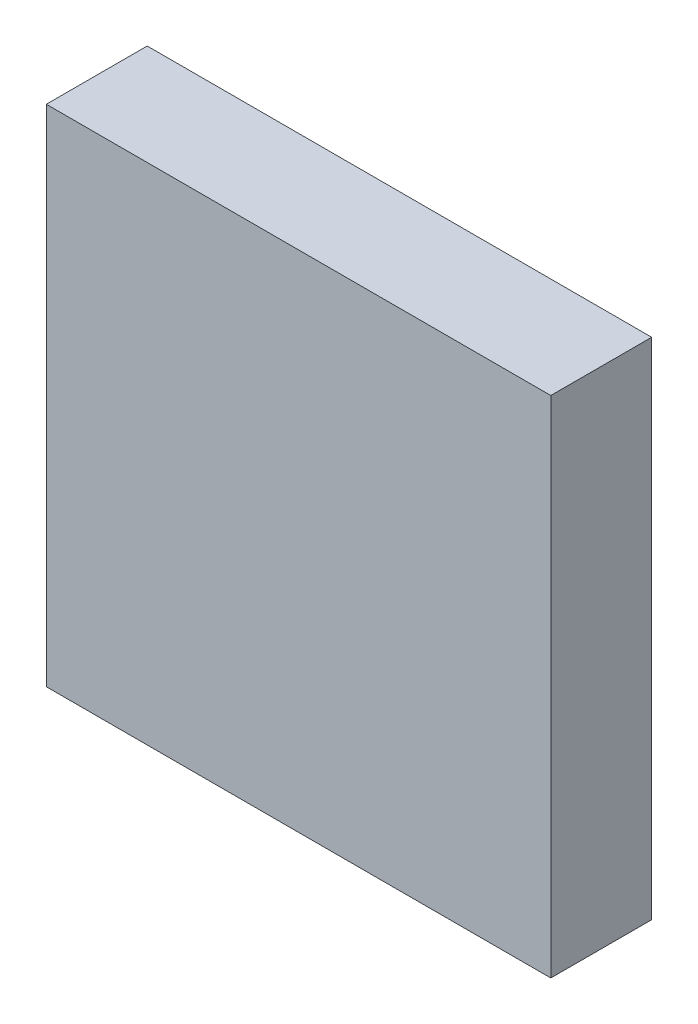
from build123d import *

# Parameters (mm, degrees)
SKETCH_216_W          = 30
SKETCH_216_H          = 30
EXTRUDE_266_DEPTH     = 6
SKETCH_329_W          = 2.034587996
SKETCH_329_H          = 1.037639878
SKETCH_329_W_2        = 1.993896236
SKETCH_329_H_2        = 1.047812818
CUT_EXTRUDE_795_DEPTH = 0.3


with BuildPart() as part:
    # Sketch 216 → Extrude 266 (new body)
    with BuildSketch(Plane.XY.offset(1.6)):
        with Locations((15, -35)):
            Rectangle(SKETCH_216_W, SKETCH_216_H)
    extrude(amount=EXTRUDE_266_DEPTH)

    # Sketch 329 → Cut-Extrude 795 (cut)
    # profile 1 of 5: a face of its own
    with BuildSketch(Plane.XY.offset(1.6)):
        Polygon((16.602238047, -31.332655137), (16.602238047, -36.861648016), (16.431841302, -36.930739234), (16.249576128, -36.998982706), (16.055442523, -37.066378433), (15.849440488, -37.132926416), (15.631570024, -37.198626653), (15.401831129, -37.263479145), (15.499463095, -37.820730191), (15.609246072, -38.29885837), (15.731180061, -38.697863683), (15.865265062, -39.017746129), (16.011501074, -39.258505708), (16.169888098, -39.420142421), (16.34325195, -39.532044761), (16.534418447, -39.623601221), (16.743387589, -39.694811801), (16.970159376, -39.745676501), (17.214733808, -39.77619532), (17.477110885, -39.78636826), (19.91861648, -39.78636826), (20.425285407, -39.744546174), (20.839832712, -39.619079914), (21.162258393, -39.409969481), (21.392562451, -39.117214875), (21.530744885, -38.740816096), (21.576805697, -38.280773143), (21.576805697, -37.263479145), (23.570701933, -37.263479145), (23.570701933, -38.056968464), (25.03560529, -38.056968464), (25.03560529, -31.332655137), (21.576805697, -31.332655137), (21.576805697, -30.08138352), (20.1017294, -30.08138352), (20.1017294, -31.332655137), align=None)
        with Locations((19.084435402, -33.133265514)):
            Rectangle(SKETCH_329_W, SKETCH_329_H, mode=Mode.SUBTRACT)
        with Locations((22.573753815, -33.133265514)):
            Rectangle(SKETCH_329_W_2, SKETCH_329_H, mode=Mode.SUBTRACT)
        with Locations((19.084435402, -35.457782299)):
            Rectangle(SKETCH_329_W, SKETCH_329_H_2, mode=Mode.SUBTRACT)
        with Locations((22.573753815, -35.457782299)):
            Rectangle(SKETCH_329_W_2, SKETCH_329_H_2, mode=Mode.SUBTRACT)
        Polygon((19.481180061, -38.524923703), (17.955239064, -38.524923703), (17.83415282, -38.521320787), (17.721826608, -38.510512038), (17.618260427, -38.492497457), (17.523454278, -38.467277043), (17.437408161, -38.434850797), (17.360122075, -38.395218718), (17.291525376, -38.349299197), (17.231547417, -38.298010625), (17.180188199, -38.241353001), (17.137447722, -38.179326325), (17.103325986, -38.111930598), (17.077822991, -38.039165819), (17.055852266, -37.954744546), (17.032327343, -37.852379338), (17.00724822, -37.732070193), (16.980614898, -37.593817113), (16.952427377, -37.437620097), (16.922685656, -37.263479145), (20.1017294, -37.263479145), (20.1017294, -37.985757884), (20.084491918, -38.150502995), (20.032779473, -38.28529445), (19.946592065, -38.390132248), (19.825929694, -38.46501639), (19.670792359, -38.509946875), align=None, mode=Mode.SUBTRACT)
    # profile 2 of 5: a face of its own
    with BuildSketch(Plane.XY.offset(1.6)):
        Polygon((5.483214649, -31.566632757), (5.497979541, -32.664179948), (5.515146377, -33.596699446), (5.534715158, -34.364191251), (5.556685882, -34.966655363), (5.581058551, -35.404091783), (5.607833164, -35.676500509), (5.641813609, -35.858906974), (5.687803775, -36.026336611), (5.745803662, -36.17878942), (5.81581327, -36.316265401), (5.897832599, -36.438764553), (5.991861648, -36.546286877), (6.117327908, -36.639397536), (6.293658867, -36.718661693), (6.520854527, -36.784079349), (6.798914886, -36.835650503), (7.127839946, -36.873375155), (7.507629705, -36.897253306), (7.559624732, -36.67062281), (7.613880411, -36.44512264), (7.670396745, -36.220752798), (7.729173731, -35.997513281), (7.790211371, -35.775404092), (7.853509664, -35.554425229), (7.604979089, -35.564386233), (7.395162202, -35.563750424), (7.224059003, -35.552517803), (7.091669492, -35.530688369), (6.99799367, -35.498262123), (6.943031536, -35.455239064), (6.910393354, -35.353297728), (6.883689386, -35.14411665), (6.862919634, -34.827695829), (6.848084096, -34.404035266), (6.839182774, -33.873134961), (6.836215666, -33.234994914), (8.016276704, -33.514750763), (8.016276704, -38.006103764), (9.399796541, -38.006103764), (9.399796541, -33.840284842), (10.406917599, -34.074262462), (10.406917599, -38.006103764), (10.391093026, -38.186390867), (10.343619306, -38.333898497), (10.264496439, -38.448626653), (10.153724426, -38.530575336), (10.011303267, -38.579744546), (9.83723296, -38.596134283), (7.365208545, -38.596134283), (7.210353792, -38.590341359), (7.071323613, -38.572962586), (6.948118006, -38.543997965), (6.840736973, -38.503447496), (6.749180513, -38.451311179), (6.673448627, -38.387589013), (6.607607098, -38.289391884), (6.545721714, -38.133830677), (6.487792472, -37.920905392), (6.433819374, -37.650616028), (6.383802419, -37.322962586), (6.337741607, -36.937945066), (6.110263366, -37.038544139), (5.882219962, -37.136882559), (5.653611394, -37.232960326), (5.424437662, -37.326777439), (5.194698768, -37.418333898), (4.96439471, -37.507629705), (5.05425568, -37.965200068), (5.15428959, -38.364699898), (5.264496439, -38.706129196), (5.384876229, -38.989487962), (5.515428959, -39.214776195), (5.656154629, -39.381993896), (5.808466147, -39.508661128), (5.973776421, -39.612297954), (6.152085453, -39.692904374), (6.343393241, -39.750480389), (6.547699785, -39.785025998), (6.765005086, -39.7965412), (10.254323499, -39.7965412), (10.723691647, -39.749915226), (11.107720131, -39.610037301), (11.406408952, -39.376907426), (11.61975811, -39.050525602), (11.747767605, -38.630891828), (11.790437436, -38.118006104), (11.790437436, -34.399796541), (12.380467955, -34.537131231), (12.675483215, -33.224821974), (11.790437436, -33.021363174), (11.790437436, -30.905391658), (10.406917599, -30.905391658), (10.406917599, -32.706002035), (9.399796541, -32.472024415), (9.399796541, -30), (8.016276704, -30), (8.016276704, -32.151576806), align=None)
    # profile 3 of 5: a face of its own
    with BuildSketch(Plane.XY.offset(1.6)):
        Polygon((14.079348932, -30.14242116), (13.814287329, -30.328642478), (13.54131344, -30.527862552), (13.260427263, -30.740081384), (12.971628801, -30.965298971), (12.674918051, -31.203515316), (12.370295015, -31.454730417), (13.306205493, -32.492370295), (13.580592291, -32.237481632), (13.854413926, -31.988244603), (14.127670397, -31.744659207), (14.400361705, -31.506725444), (14.672487849, -31.274443314), (14.94404883, -31.047812818), align=None)
    # profile 4 of 5: a face of its own
    with BuildSketch(Plane.XY.offset(1.6)):
        Polygon((14.191251272, -32.848423194), (13.893692777, -33.062054934), (13.604611733, -33.275686673), (13.324008138, -33.489318413), (13.051881994, -33.702950153), (12.788233299, -33.916581892), (12.533062055, -34.130213632), (13.519837233, -35.18819939), (13.736012208, -34.977393467), (13.970837572, -34.758675257), (14.224313327, -34.532044761), (14.496439471, -34.297501978), (14.787216005, -34.055046909), (15.09664293, -33.804679552), align=None)
    # profile 5 of 5: a face of its own
    with BuildSketch(Plane.XY.offset(1.6)):
        Polygon((13.794506612, -35.595116989), (13.535096643, -35.706171584), (13.285859613, -35.808748728), (13.046795524, -35.902848423), (12.817904374, -35.988470668), (12.599186165, -36.065615463), (12.390640895, -36.134282808), (12.562450548, -36.713575223), (12.745563468, -37.318865152), (12.939979654, -37.950152594), (13.145699107, -38.607437549), (13.362721827, -39.290720018), (13.591047813, -40), (15.00508647, -39.532044761), (14.784955352, -38.905561207), (14.572171358, -38.267209223), (14.366734486, -37.61698881), (14.168644738, -36.954899966), (13.977902114, -36.280942692), align=None)
    extrude(amount=CUT_EXTRUDE_795_DEPTH, mode=Mode.SUBTRACT)


solid = part.part
